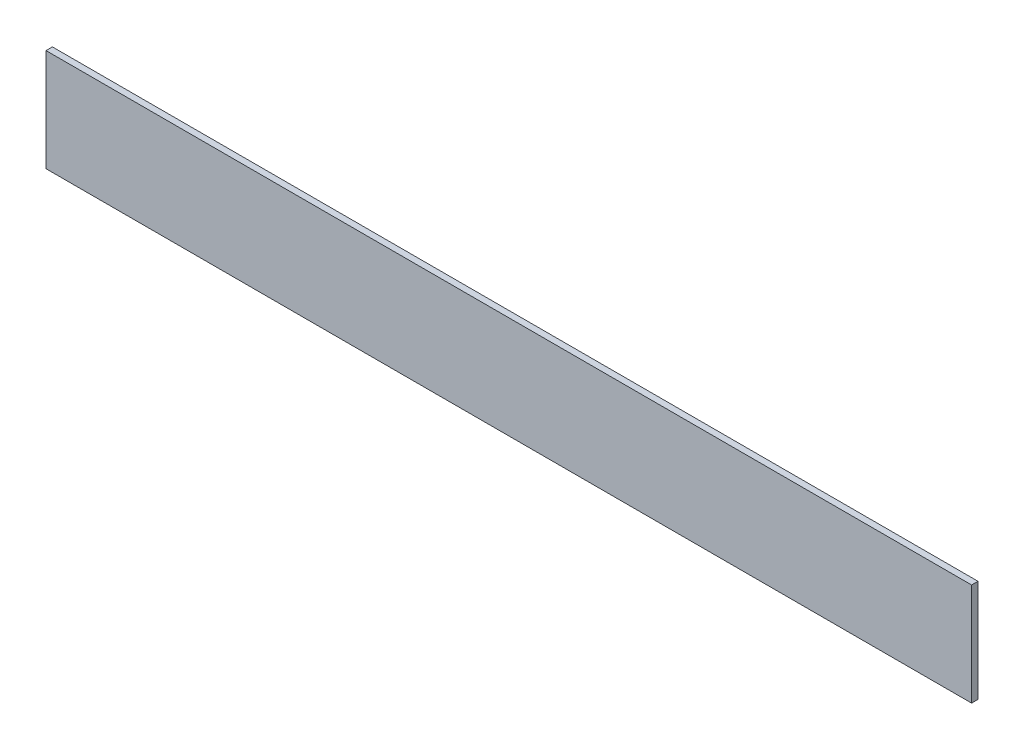
from build123d import *

# Parameters (mm, degrees)
SKETCH1_W           = 459.49
SKETCH1_H           = 50.8
BOSS_EXTRUDE1_DEPTH = 3.175


with BuildPart() as part:
    # Sketch1 → Boss-Extrude1 (new body)
    with BuildSketch(Plane.XY):
        Rectangle(SKETCH1_W, SKETCH1_H)
    extrude(amount=BOSS_EXTRUDE1_DEPTH)


solid = part.part
